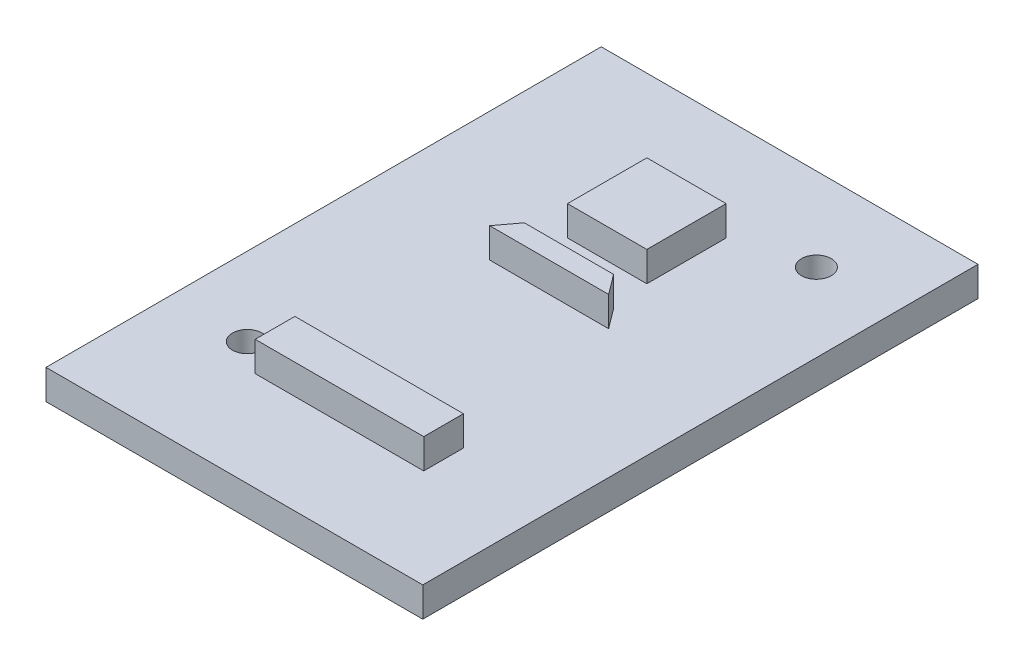
from build123d import *

# Parameters (mm, degrees)
SKETCH1_W           = 13.5
SKETCH1_H           = 20
BOSS_EXTRUDE1_DEPTH = 1.5
SKETCH2_W           = 4
SKETCH2_H           = 4
BOSS_EXTRUDE2_DEPTH = 1.5
SKETCH3_R           = 0.75
CUT_EXTRUDE1_DEPTH  = 1.5
SKETCH4_W           = 8.5
SKETCH4_H           = 2
BOSS_EXTRUDE3_DEPTH = 1.5
SKETCH5_W           = 19
SKETCH5_H           = 28
SKETCH5_W_2         = 13.5
SKETCH5_H_2         = 20
BOSS_EXTRUDE4_DEPTH = 1.5


with BuildPart() as part:
    # Sketch1 → Boss-Extrude1 (new body)
    with BuildSketch(Plane(origin=(0, 0, 0), x_dir=(1, 0, 0), z_dir=(0, 1, 0))):
        with Locations((6.75, 10)):
            Rectangle(SKETCH1_W, SKETCH1_H)
    extrude(amount=BOSS_EXTRUDE1_DEPTH)

    # Sketch2 → Boss-Extrude2 (add)
    with BuildSketch(Plane(origin=(0, 1.5, 0), x_dir=(1, 0, 0), z_dir=(0, 1, 0))):
        with Locations((6.75, 15.8)):
            Rectangle(SKETCH2_W, SKETCH2_H)
        Polygon((4.5, 11.87318686), (9, 11.87318686), (9.75, 10.87318686), (3.75, 10.87318686), align=None)
    extrude(amount=BOSS_EXTRUDE2_DEPTH)

    # Sketch3 → Cut-Extrude1 (cut)
    with BuildSketch(Plane.XZ):
        with Locations(Location((12.3, -18.8, 0), (0, 0, 270))):
            Circle(SKETCH3_R)
        with Locations(Location((1.2, -1.2, 0), (0, 0, 270))):
            Circle(SKETCH3_R)
    extrude(amount=-CUT_EXTRUDE1_DEPTH, mode=Mode.SUBTRACT)

    # Sketch4 → Boss-Extrude3 (add)
    with BuildSketch(Plane(origin=(0, 1.5, 0), x_dir=(1, 0, 0), z_dir=(0, 1, 0))):
        with Locations((7.05, 1)):
            Rectangle(SKETCH4_W, SKETCH4_H)
    extrude(amount=BOSS_EXTRUDE3_DEPTH)

    # Sketch5 → Boss-Extrude4 (add)
    with BuildSketch(Plane(origin=(0, 1.5, 0), x_dir=(1, 0, 0), z_dir=(0, 1, 0))):
        with Locations((6.75, 9)):
            Rectangle(SKETCH5_W, SKETCH5_H)
        with Locations((6.75, 10)):
            Rectangle(SKETCH5_W_2, SKETCH5_H_2, mode=Mode.SUBTRACT)
    extrude(amount=-BOSS_EXTRUDE4_DEPTH)


solid = part.part
